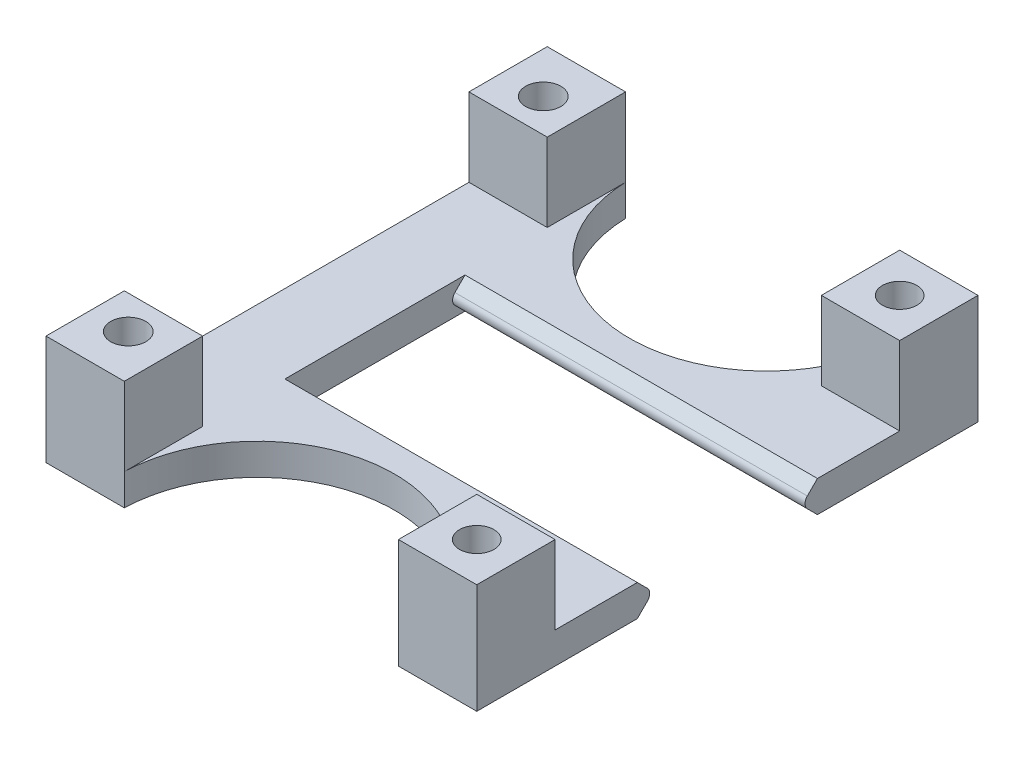
from build123d import *

# Parameters (mm, degrees)
SKETCH1_R           = 2.2479
SKETCH1_R_2         = 2.2
EXTRUDE_BODY_DEPTH  = 4
SKETCH5_W           = 10
SKETCH5_H           = 10
SKETCH5_R           = 2.2
SKETCH5_R_2         = 2.2479
EXTRUDE_LEGS_DEPTH  = 10
SKETCH6_W           = 45
SKETCH6_H           = 0.5
BOSS_EXTRUDE1_DEPTH = 4
CUT_EXTRUDE1_DEPTH  = 45


with BuildPart() as part:
    # Sketch1 → Extrude-Body (new body)
    with BuildSketch(Plane(origin=(0, 0, 0), x_dir=(1, 0, 0), z_dir=(0, 1, 0))):
        with BuildLine():
            Line((10, -10), (10, 10))
            Line((10, 10), (45, 10))
            Line((45, 10), (55, 10))
            Line((55, 10), (55, 20))
            Line((55, 20), (55, 32))
            Line((55, 32), (45, 32))
            ThreePointArc((45, 32), (27.5, 15), (10, 32))
            Line((10, 32), (0, 32))
            Line((0, 32), (0, 20))
            Line((0, 20), (0, -20))
            Line((0, -20), (0, -32))
            Line((0, -32), (10, -32))
            ThreePointArc((10, -32), (27.5, -15), (45, -32))
            Line((45, -32), (55, -32))
            Line((55, -32), (55, -20))
            Line((55, -20), (55, -10))
            Line((55, -10), (45, -10))
            Line((45, -10), (10, -10))
        make_face()
        with Locations(Location((4.755333622, -26.250570114, 0), (0, 0, 270))):
            Circle(SKETCH1_R, mode=Mode.SUBTRACT)
        with Locations(Location((50, -27, 0), (0, 0, 270))):
            Circle(SKETCH1_R_2, mode=Mode.SUBTRACT)
        with Locations(Location((5.244634233, 26.247149693, 0), (0, 0, 270))):
            Circle(SKETCH1_R, mode=Mode.SUBTRACT)
        with Locations(Location((50, 27, 0), (0, 0, 270))):
            Circle(SKETCH1_R_2, mode=Mode.SUBTRACT)
    extrude(amount=EXTRUDE_BODY_DEPTH)

    # Sketch5 → Extrude-Legs (add)
    # profile 1 of 4: a face of its own
    with BuildSketch(Plane(origin=(0, 4, 0), x_dir=(1, 0, 0), z_dir=(0, 1, 0))):
        with Locations((50, -27)):
            Rectangle(SKETCH5_W, SKETCH5_H)
        with Locations(Location((50, -27, 0), (0, 0, 270))):
            Circle(SKETCH5_R, mode=Mode.SUBTRACT)
    # profile 2 of 4: a face of its own
    with BuildSketch(Plane(origin=(0, 4, 0), x_dir=(1, 0, 0), z_dir=(0, 1, 0))):
        with Locations((50, 27)):
            Rectangle(SKETCH5_W, SKETCH5_H)
        with Locations(Location((50, 27, 0), (0, 0, 270))):
            Circle(SKETCH5_R, mode=Mode.SUBTRACT)
    # profile 3 of 4: a face of its own
    with BuildSketch(Plane(origin=(0, 4, 0), x_dir=(1, 0, 0), z_dir=(0, 1, 0))):
        with Locations((5, 27)):
            Rectangle(SKETCH5_W, SKETCH5_H)
        with Locations(Location((5.244634233, 26.247149693, 0), (0, 0, 270))):
            Circle(SKETCH5_R_2, mode=Mode.SUBTRACT)
    # profile 4 of 4: a face of its own
    with BuildSketch(Plane(origin=(0, 4, 0), x_dir=(1, 0, 0), z_dir=(0, 1, 0))):
        with Locations((5, -27)):
            Rectangle(SKETCH5_W, SKETCH5_H)
        with Locations(Location((4.755333622, -26.250570114, 0), (0, 0, 270))):
            Circle(SKETCH5_R_2, mode=Mode.SUBTRACT)
    extrude(amount=EXTRUDE_LEGS_DEPTH)

    # Sketch6 → Boss-Extrude1 (add)
    with BuildSketch(Plane(origin=(0, 4, 0), x_dir=(1, 0, 0), z_dir=(0, 1, 0))):
        with Locations((32.5, -9.75)):
            Rectangle(SKETCH6_W, SKETCH6_H)
        with Locations((32.5, 9.75)):
            Rectangle(SKETCH6_W, SKETCH6_H)
    extrude(amount=-BOSS_EXTRUDE1_DEPTH)

    # Sketch7 → Cut-Extrude1 (cut)
    with BuildSketch(Plane(origin=(55, 0, 0), x_dir=(0, 0, -1), z_dir=(1, 0, 0))):
        with BuildLine():
            Line((-10.207106781, 2.707106781), (-11.5, 4))
            Line((-11.5, 4), (-9.5, 4))
            Line((-9.5, 4), (-9.5, 0))
            Line((-9.5, 0), (-11.5, 0))
            Line((-11.5, 0), (-10.207106781, 1.292893219))
            ThreePointArc((-10.207106781, 1.292893219), (-9.914213562, 2), (-10.207106781, 2.707106781))
        make_face()
        with BuildLine():
            Line((10.207106781, 2.707106781), (11.5, 4))
            Line((11.5, 4), (9.5, 4))
            Line((9.5, 4), (9.5, 0))
            Line((9.5, 0), (11.5, 0))
            Line((11.5, 0), (10.207106781, 1.292893219))
            ThreePointArc((10.207106781, 1.292893219), (9.914213562, 2), (10.207106781, 2.707106781))
        make_face()
    extrude(amount=-CUT_EXTRUDE1_DEPTH, mode=Mode.SUBTRACT)


solid = part.part
